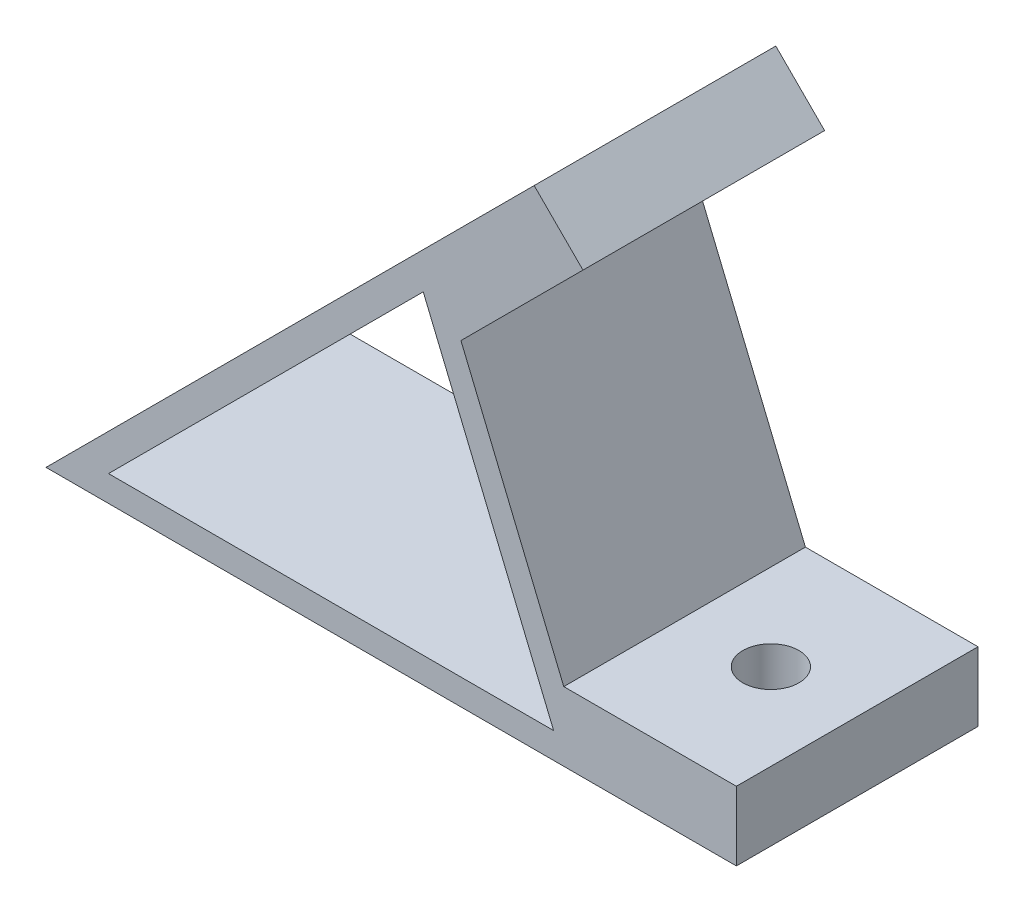
from build123d import *

# Parameters (mm, degrees)
EXTRUDE_1_DEPTH     = 28
SKETCH_3_R          = 3.25
CUT_EXTRUDE_1_DEPTH = 10
SKETCH_4_R          = 3.25
CUT_EXTRUDE_2_DEPTH = 10


with BuildPart() as part:
    # 草图2 → 凸台-拉伸1 (new body)
    with BuildSketch(Plane.XY):
        Polygon((56.568542495, 56.568542495), (0, 0), (80, 0), (80, 8), (60, 8), (48.083261121, 36.769552622), (62.225396744, 50.911688245), align=None)
        Polygon((7.242640687, 3), (43.716092715, 39.473452028), (58.823891211, 3), align=None, mode=Mode.SUBTRACT)
    extrude(amount=EXTRUDE_1_DEPTH)

    # 草图3 → 切除-拉伸1 (cut)
    with BuildSketch(Plane(origin=(0, 8, 0), x_dir=(1, 0, 0), z_dir=(0, 1, 0))):
        with Locations(Location((70, -14, 0), (0, 0, 270))):
            Circle(SKETCH_3_R)
    extrude(amount=-CUT_EXTRUDE_1_DEPTH, mode=Mode.SUBTRACT)

    # 草图4 → 切除-拉伸2 (cut)
    with BuildSketch(Plane(origin=(5.656854249, -5.656854249, 0), x_dir=(0, 0, -1), z_dir=(0.7071067811865439, -0.7071067811865511, 0))):
        with Locations(Location((-14, 70, 0), (0, 0, 90))):
            Circle(SKETCH_4_R)
    extrude(amount=-CUT_EXTRUDE_2_DEPTH, mode=Mode.SUBTRACT)


solid = part.part
